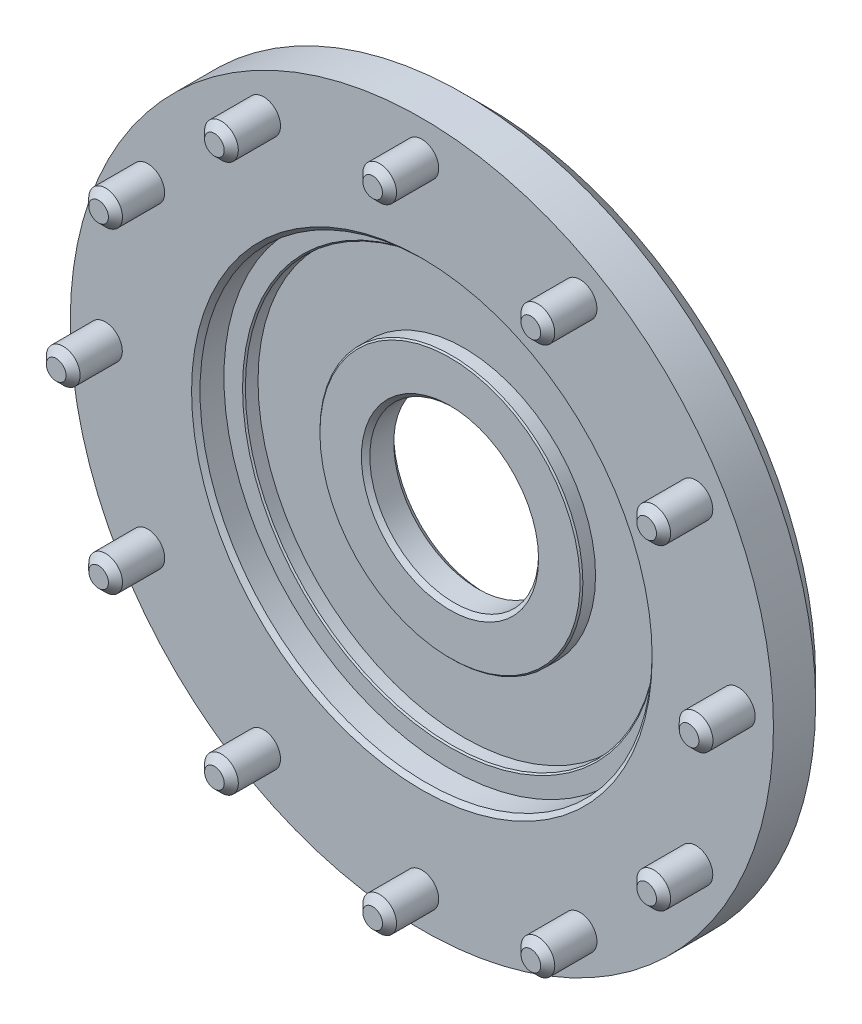
from build123d import *

# Parameters (mm, degrees)
SKETCH1_R                    = 50
BOSS_EXTRUDE1_DEPTH          = 9
SKETCH2_R                    = 2.4
BOSS_EXTRUDE2_DEPTH          = 7
CHAMFER1_SIZE                = 1
CIRPATTERN1_COUNT            = 12
CHAMFER1_OF_CIRPATTERN1_SIZE = 1
SKETCH3_R                    = 32.15
CUT_EXTRUDE1_DEPTH           = 4
SKETCH4_R                    = 12
CUT_EXTRUDE2_DEPTH           = 72.281133549
CHAMFER2_SIZE                = 0.6
SKETCH5_R                    = 29.3
SKETCH5_R_2                  = 18.7
CUT_EXTRUDE3_DEPTH           = 2
CHAMFER3_SIZE                = 0.2
CHAMFER4_SIZE                = 3
CHAMFER5_SIZE                = 1
CHAMFER6_SIZE                = 0.6
SCALE1_SCALE                 = 0.4


with BuildPart() as part:
    # Sketch1 → Boss-Extrude1 (new body)
    with BuildSketch(Plane.XY):
        Circle(SKETCH1_R)
    extrude(amount=-BOSS_EXTRUDE1_DEPTH)

    # Sketch2 → Boss-Extrude2 (add)
    with BuildSketch(Plane.XY):
        with Locations((45, 0)):
            Circle(SKETCH2_R)
    boss_extrude2 = extrude(amount=BOSS_EXTRUDE2_DEPTH)

    # Chamfer1
    chamfer1_edges = [part.edges().sort_by_distance(p)[0] for p in [
        (42.6, 0, 7),
    ]]
    chamfer(chamfer1_edges, length=CHAMFER1_SIZE)

    # CirPattern1: Boss-Extrude2 ×12 about axis
    cirpattern1_axis = Axis((0, 0, 0), (0, 0, 1))
    for i in range(1, CIRPATTERN1_COUNT):
        add(boss_extrude2.rotate(cirpattern1_axis, i * 360 / CIRPATTERN1_COUNT))

    # Chamfer1 of CirPattern1
    chamfer1_of_cirpattern1_edges = [part.edges().sort_by_distance(p)[0] for p in [
        (36.892682201, 21.3, 7),
        (21.3, 36.892682201, 7),
        (0, 42.6, 7),
        (-21.3, 36.892682201, 7),
        (-36.892682201, 21.3, 7),
        (-42.6, 0, 7),
        (-36.892682201, -21.3, 7),
        (-21.3, -36.892682201, 7),
        (0, -42.6, 7),
        (21.3, -36.892682201, 7),
        (36.892682201, -21.3, 7),
    ]]
    chamfer(chamfer1_of_cirpattern1_edges, length=CHAMFER1_OF_CIRPATTERN1_SIZE)

    # Sketch3 → Cut-Extrude1 (cut)
    with BuildSketch(Plane.XY):
        Circle(SKETCH3_R)
    extrude(amount=-CUT_EXTRUDE1_DEPTH, mode=Mode.SUBTRACT)

    # Sketch4 → Cut-Extrude2 (cut, through all)
    with BuildSketch(Plane.XY):
        Circle(SKETCH4_R)
    extrude(amount=-CUT_EXTRUDE2_DEPTH, mode=Mode.SUBTRACT)

    # Chamfer2
    chamfer2_edges = [part.edges().sort_by_distance(p)[0] for p in [
        (-32.15, 0, 0),
    ]]
    chamfer(chamfer2_edges, length=CHAMFER2_SIZE)

    # Sketch5 → Cut-Extrude3 (cut)
    with BuildSketch(Plane.XY.offset(-4)):
        Circle(SKETCH5_R)
        Circle(SKETCH5_R_2, mode=Mode.SUBTRACT)
    extrude(amount=-CUT_EXTRUDE3_DEPTH, mode=Mode.SUBTRACT)

    # Chamfer3
    chamfer3_edges = [part.edges().sort_by_distance(p)[0] for p in [
        (-29.3, 0, -4),
        (-18.7, 0, -4),
    ]]
    chamfer(chamfer3_edges, length=CHAMFER3_SIZE)

    # Chamfer4
    chamfer4_edges = [part.edges().sort_by_distance(p)[0] for p in [
        (-50, 0, -9),
    ]]
    chamfer(chamfer4_edges, length=CHAMFER4_SIZE)

    # Chamfer5
    chamfer5_edges = [part.edges().sort_by_distance(p)[0] for p in [
        (-12, 0, -9),
    ]]
    chamfer(chamfer5_edges, length=CHAMFER5_SIZE)

    # Chamfer6
    chamfer6_edges = [part.edges().sort_by_distance(p)[0] for p in [
        (-12, 0, -4),
    ]]
    chamfer(chamfer6_edges, length=CHAMFER6_SIZE)


with BuildPart() as part_1:
    # Scale1: scaled about (0, 0, -4.695771531)
    add(part.part.scale(SCALE1_SCALE).moved(Location((0, 0, -2.817462919))))


solid = part_1.part
